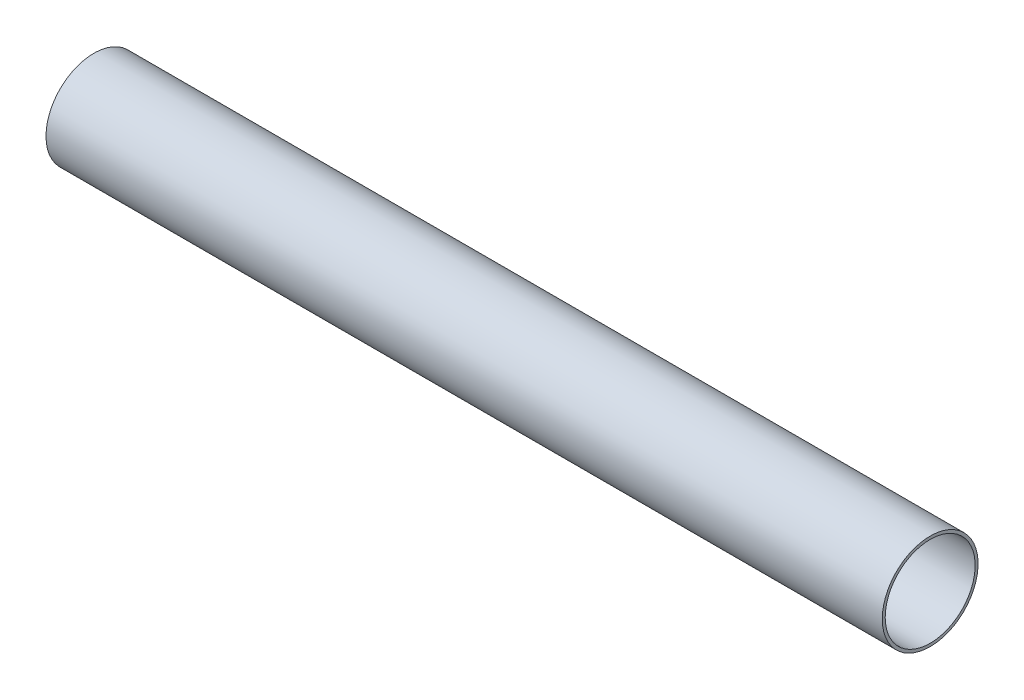
from build123d import *

# Parameters (mm, degrees)
SKETCH1_R      = 17.4625
SKETCH1_R_2    = 16.3957
EXTRUDE1_DEPTH = 152.4


with BuildPart() as part:
    # Sketch1 → Extrude1 (new, symmetric)
    with BuildSketch(Plane(origin=(0, 0, 0), x_dir=(0, 0, -1), z_dir=(1, 0, 0))):
        with Locations(Location((0, 0, 0), (0, 0, 180))):
            Circle(SKETCH1_R)
        with Locations(Location((0, 0, 0), (0, 0, 180))):
            Circle(SKETCH1_R_2, mode=Mode.SUBTRACT)
    extrude(amount=EXTRUDE1_DEPTH, both=True)


solid = part.part
